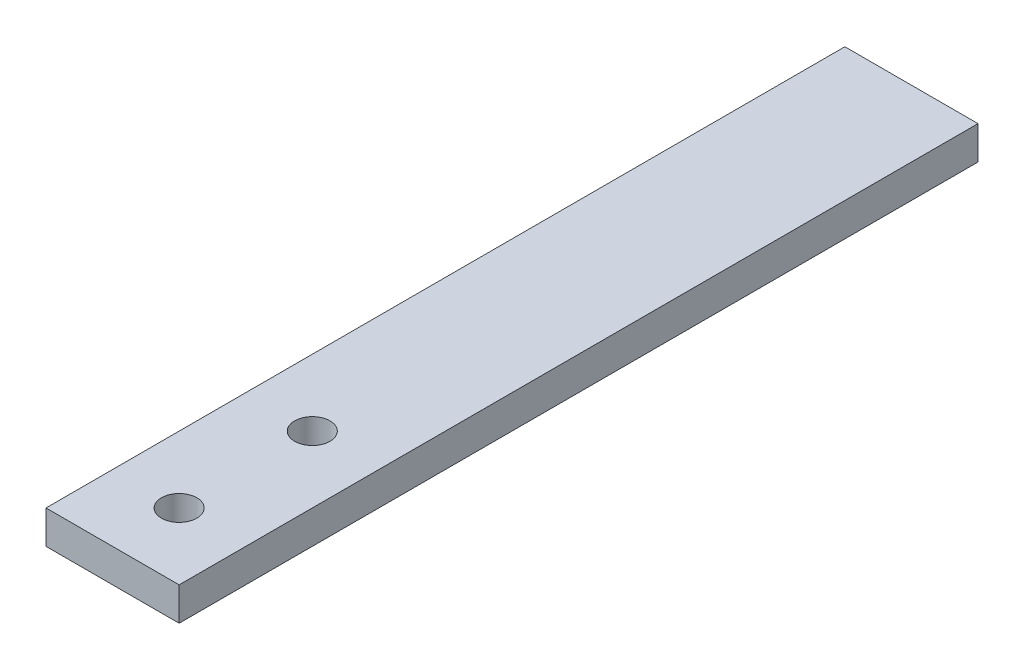
from build123d import *

# Parameters (mm, degrees)
SKETCH1_W               = 25.4
SKETCH1_H               = 152.4
BOSS_EXTRUDE1_DEPTH     = 3.175
F_1_4_CLEARANCE_HOLE1_D = 6.7564


with BuildPart() as part:
    # Sketch1 → Boss-Extrude1 (new, symmetric)
    with BuildSketch(Plane(origin=(0, 0, 0), x_dir=(1, 0, 0), z_dir=(0, 1, 0))):
        Rectangle(SKETCH1_W, SKETCH1_H)
    extrude(amount=BOSS_EXTRUDE1_DEPTH, both=True)

    # 1/4 Clearance Hole1 (through all)
    with Locations(Plane(origin=(0, 3.175, 0), x_dir=(1, 0, 0), z_dir=(0, 1, 0))):
        with Locations((0, -63.5), (0, -38.1)):
            Hole(F_1_4_CLEARANCE_HOLE1_D / 2)


solid = part.part
